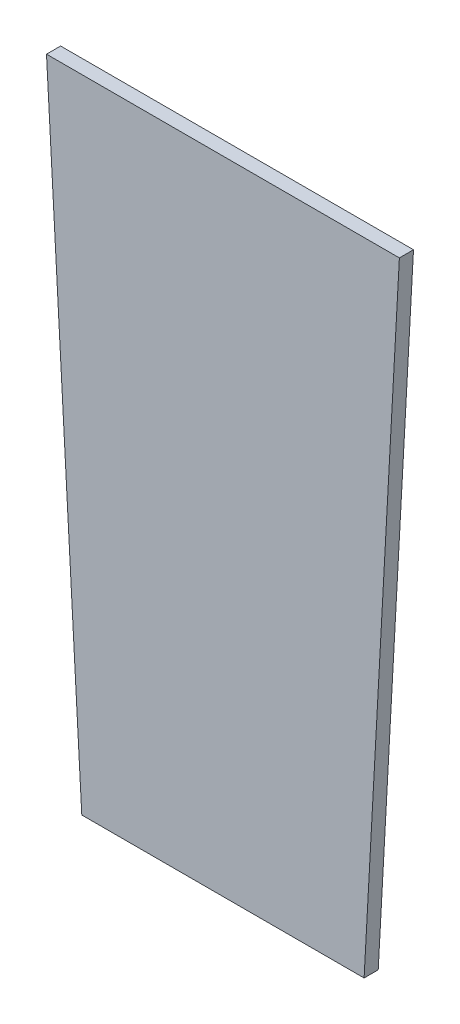
from build123d import *

# Parameters (mm, degrees)
DODANIE_WYCI_GNI_CIE1_DEPTH = 10


with BuildPart() as part:
    # Szkic1 → Dodanie-wyciągnięcie1 (new body)
    with BuildSketch(Plane.XY):
        Polygon((-125, 249.582937934), (125, 249.582937934), (100, -204.72972973), (-100, -204.72972973), align=None)
    extrude(amount=DODANIE_WYCI_GNI_CIE1_DEPTH)


solid = part.part
